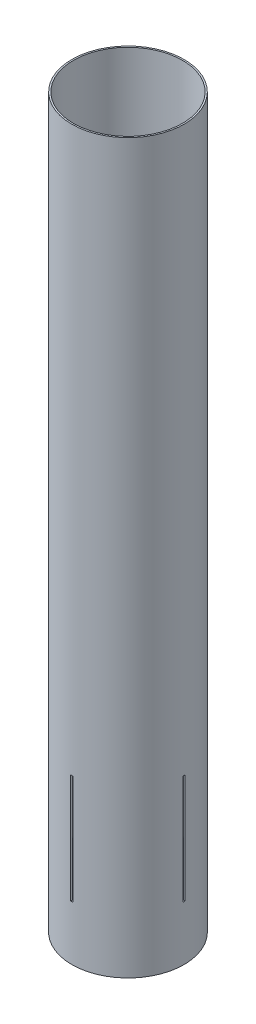
from build123d import *

# Parameters (mm, degrees)
SKETCH1_R           = 78.359
SKETCH1_R_2         = 76.2
BOSS_EXTRUDE1_DEPTH = 1016
SKETCH2_W           = 3.175
SKETCH2_H           = 152.4
CUT_EXTRUDE1_DEPTH  = 1023.025570014
CIRPATTERN1_COUNT   = 4


with BuildPart() as part:
    # Sketch1 → Boss-Extrude1 (new body)
    with BuildSketch(Plane(origin=(0, 0, 0), x_dir=(1, 0, 0), z_dir=(0, 1, 0))):
        with Locations(Location((0, 0, 0), (0, 0, 270))):
            Circle(SKETCH1_R)
        with Locations(Location((0, 0, 0), (0, 0, 270))):
            Circle(SKETCH1_R_2, mode=Mode.SUBTRACT)
    extrude(amount=BOSS_EXTRUDE1_DEPTH)

    # Sketch2 → Cut-Extrude1 (cut, through all)
    with BuildSketch(Plane(origin=(0, 0, 0), x_dir=(0, 0, -1), z_dir=(1, 0, 0))):
        with Locations((0, 152.4)):
            Rectangle(SKETCH2_W, SKETCH2_H)
    cut_extrude1 = extrude(amount=-CUT_EXTRUDE1_DEPTH, mode=Mode.SUBTRACT)

    # CirPattern1: Cut-Extrude1 ×4 about axis
    cirpattern1_axis = Axis((0, 0, 0), (0, 1, 0))
    for i in range(1, CIRPATTERN1_COUNT):
        add(cut_extrude1.rotate(cirpattern1_axis, i * 360 / CIRPATTERN1_COUNT), mode=Mode.SUBTRACT)


solid = part.part
